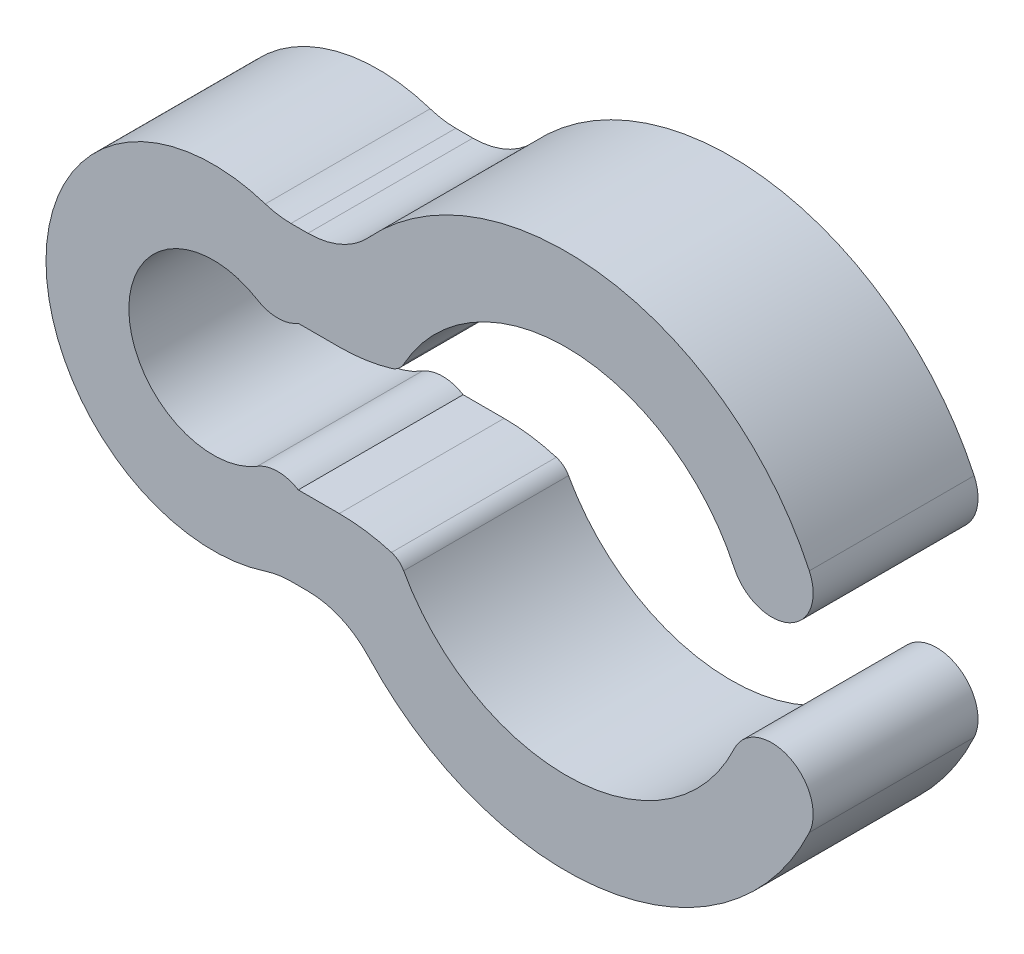
from build123d import *

# Parameters (mm, degrees)
BOSS_EXTRUDE1_DEPTH = 4


with BuildPart() as part:
    # Sketch1 → Boss-Extrude1 (new body)
    with BuildSketch(Plane.XY):
        with BuildLine():
            Line((-6.676917421, 3.76), (-6.264383449, 3.76))
            ThreePointArc((-6.264383449, 3.76), (-5.460456542, 3.928688577), (-4.792142921, 4.406298472))
            ThreePointArc((-4.792142921, 4.406298472), (0.997233115, 6.433166103), (5.90126525, 2.748666667))
            ThreePointArc((5.90126525, 2.748666667), (5.414573764, 1.413308514), (4.079215611, 1.9))
            ThreePointArc((4.079215611, 1.9), (0.152344996, 4.497420483), (-3.941291901, 2.171685556))
            ThreePointArc((-3.941291901, 2.171685556), (-4.065842636, 2.023370199), (-4.237411909, 1.933513005))
            ThreePointArc((-4.237411909, 1.933513005), (-4.864598448, 1.796116159), (-5.505, 1.75))
            Line((-5.505, 1.75), (-6.498646087, 1.75))
            ThreePointArc((-6.498646087, 1.75), (-6.995469131, 1.610404776), (-7.492292175, 1.75))
            ThreePointArc((-7.492292175, 1.75), (-10.61, 0), (-7.492292175, -1.75))
            ThreePointArc((-7.492292175, -1.75), (-6.995469131, -1.610404776), (-6.498646087, -1.75))
            Line((-6.498646087, -1.75), (-5.505, -1.75))
            ThreePointArc((-5.505, -1.75), (-4.864598448, -1.796116159), (-4.237411909, -1.933513005))
            ThreePointArc((-4.237411909, -1.933513005), (-4.065842636, -2.023370199), (-3.941291901, -2.171685556))
            ThreePointArc((-3.941291901, -2.171685556), (0.152344996, -4.497420483), (4.079215611, -1.9))
            ThreePointArc((4.079215611, -1.9), (5.414573764, -1.413308514), (5.90126525, -2.748666667))
            ThreePointArc((5.90126525, -2.748666667), (0.997233115, -6.433166103), (-4.792142921, -4.406298472))
            ThreePointArc((-4.792142921, -4.406298472), (-5.460456542, -3.928688577), (-6.264383449, -3.76))
            Line((-6.264383449, -3.76), (-6.676917421, -3.76))
            ThreePointArc((-6.676917421, -3.76), (-6.991575809, -3.784907572), (-7.29839682, -3.859009901))
            ThreePointArc((-7.29839682, -3.859009901), (-12.62, 0), (-7.29839682, 3.859009901))
            ThreePointArc((-7.29839682, 3.859009901), (-6.991575809, 3.784907572), (-6.676917421, 3.76))
        make_face()
    extrude(amount=BOSS_EXTRUDE1_DEPTH)


solid = part.part
